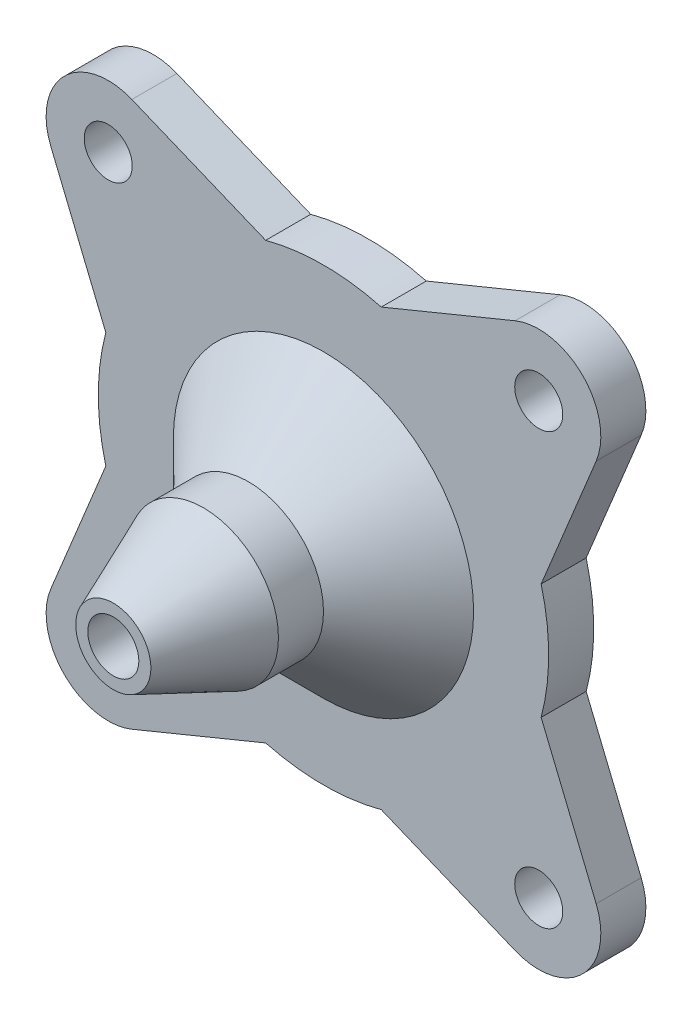
from build123d import *

# Parameters (mm, degrees)
SKETCH1_R               = 15
BOSS_EXTRUDE1_DEPTH     = 3
BOSS_EXTRUDE2_START     = -1.5
SKETCH2_R               = 1.6
BOSS_EXTRUDE2_DEPTH     = 1.5
MIRROR2_START           = -1.5
MIRROR2_COPY_1_SKETCH_R = 1.6
MIRROR2_COPY_1_DEPTH    = 1.5
SKETCH3_R               = 5
BOSS_EXTRUDE3_DEPTH     = 8
CHAMFER1_SIZE           = 5
SKETCH5_R               = 1.7
CUT_EXTRUDE1_DEPTH      = 12


with BuildPart() as part:
    # Sketch1 → Boss-Extrude1 (new body)
    with BuildSketch(Plane.XY):
        Circle(SKETCH1_R)
    extrude(amount=BOSS_EXTRUDE1_DEPTH)

    # Sketch2 → Boss-Extrude2 (add, symmetric)
    with BuildSketch(Plane.XY.offset(3).offset(BOSS_EXTRUDE2_START)):
        with BuildLine():
            Line((-18.163571809, 12.764485711), (-14.497712513, 3.849198865))
            ThreePointArc((-14.497712513, 3.849198865), (-10.606601718, 10.606601718), (-3.849198865, 14.497712513))
            Line((-3.849198865, 14.497712513), (-12.764485711, 18.163571809))
            ThreePointArc((-12.764485711, 18.163571809), (-17.262762767, 17.262762767), (-18.163571809, 12.764485711))
        make_face()
        with Locations((-14.33765637, 14.33765637)):
            Circle(SKETCH2_R, mode=Mode.SUBTRACT)
    boss_extrude2 = extrude(amount=BOSS_EXTRUDE2_DEPTH, both=True)

    # Mirror1: Boss-Extrude2 across plane
    add(boss_extrude2.mirror(Plane(origin=(0, 0, 0), x_dir=(0, 0, 1), z_dir=(1, 0, 0))))

    # Mirror2: Boss-Extrude2 across plane
    add(boss_extrude2.mirror(Plane.ZX))

    # Mirror2 copy 1 sketch → Mirror2 copy 1 (add, symmetric)
    with BuildSketch(Plane(origin=(0, 0, 3), x_dir=(-1, 0, 0), z_dir=(0, 0, 1)).offset(MIRROR2_START)):
        with BuildLine():
            Line((-18.163571809, 12.764485711), (-14.497712513, 3.849198865))
            ThreePointArc((-14.497712513, 3.849198865), (-10.606601718, 10.606601718), (-3.849198865, 14.497712513))
            Line((-3.849198865, 14.497712513), (-12.764485711, 18.163571809))
            ThreePointArc((-12.764485711, 18.163571809), (-17.262762767, 17.262762767), (-18.163571809, 12.764485711))
        make_face()
        with Locations((-14.33765637, 14.33765637)):
            Circle(MIRROR2_COPY_1_SKETCH_R, mode=Mode.SUBTRACT)
    extrude(amount=MIRROR2_COPY_1_DEPTH, both=True)

    # Sketch3 → Boss-Extrude3 (add)
    with BuildSketch(Plane.XY.offset(3)):
        Circle(SKETCH3_R)
    extrude(amount=BOSS_EXTRUDE3_DEPTH)

    # Sketch4 → Revolve1 (revolve)
    with BuildSketch(Plane(origin=(0, 0, 0), x_dir=(1, 0, 0), z_dir=(0, 1, 0))):
        Polygon((0, -11), (-5, -11), (-2.5, -17), (0, -17), align=None)
    revolve(axis=Axis((0, 0, 11), (0, 0, 1)))

    # Chamfer1
    chamfer1_edges = [part.edges().sort_by_distance(p)[0] for p in [
        (-5, 0, 3),
    ]]
    chamfer(chamfer1_edges, length=CHAMFER1_SIZE)

    # Sketch5 → Cut-Extrude1 (cut)
    with BuildSketch(Plane.XY.offset(17)):
        Circle(SKETCH5_R)
    extrude(amount=-CUT_EXTRUDE1_DEPTH, mode=Mode.SUBTRACT)


solid = part.part
